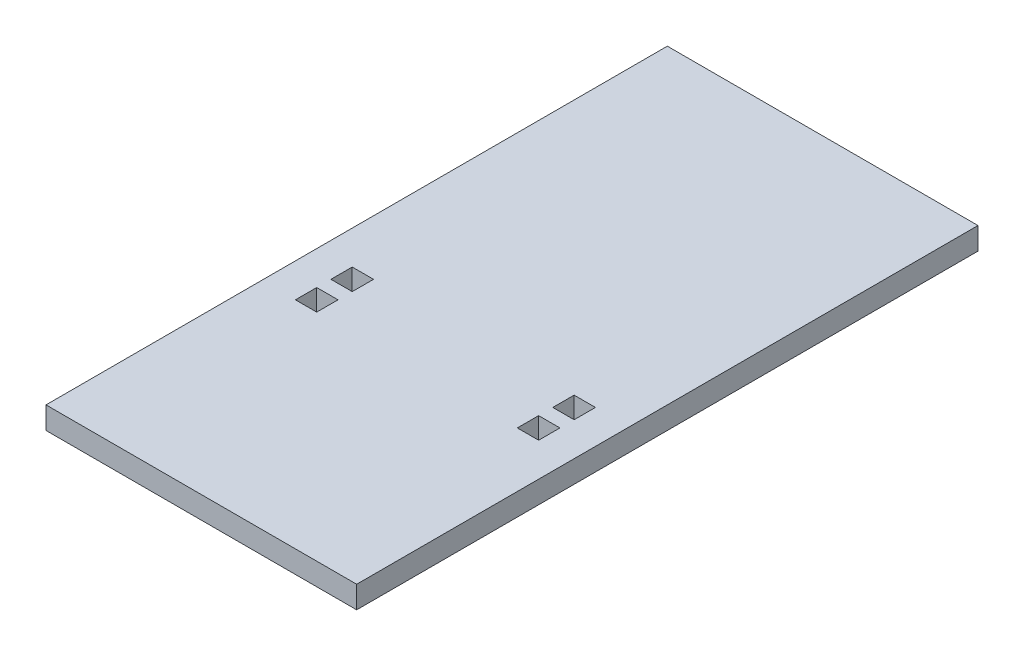
from build123d import *

# Parameters (mm, degrees)
SKETCH1_W           = 70
SKETCH1_H           = 140
SKETCH1_W_2         = 4.8
SKETCH1_H_2         = 4.8
BOSS_EXTRUDE1_DEPTH = 5


with BuildPart() as part:
    # Sketch1 → Boss-Extrude1 (new body)
    with BuildSketch(Plane(origin=(0, 0, 0), x_dir=(1, 0, 0), z_dir=(0, 1, 0))):
        Rectangle(SKETCH1_W, SKETCH1_H)
        with Locations((-25, -19)):
            Rectangle(SKETCH1_W_2, SKETCH1_H_2, mode=Mode.SUBTRACT)
        with Locations((-25, -11)):
            Rectangle(SKETCH1_W_2, SKETCH1_H_2, mode=Mode.SUBTRACT)
        with Locations((25, -11)):
            Rectangle(SKETCH1_W_2, SKETCH1_H_2, mode=Mode.SUBTRACT)
        with Locations((25, -19)):
            Rectangle(SKETCH1_W_2, SKETCH1_H_2, mode=Mode.SUBTRACT)
    extrude(amount=BOSS_EXTRUDE1_DEPTH)


solid = part.part
